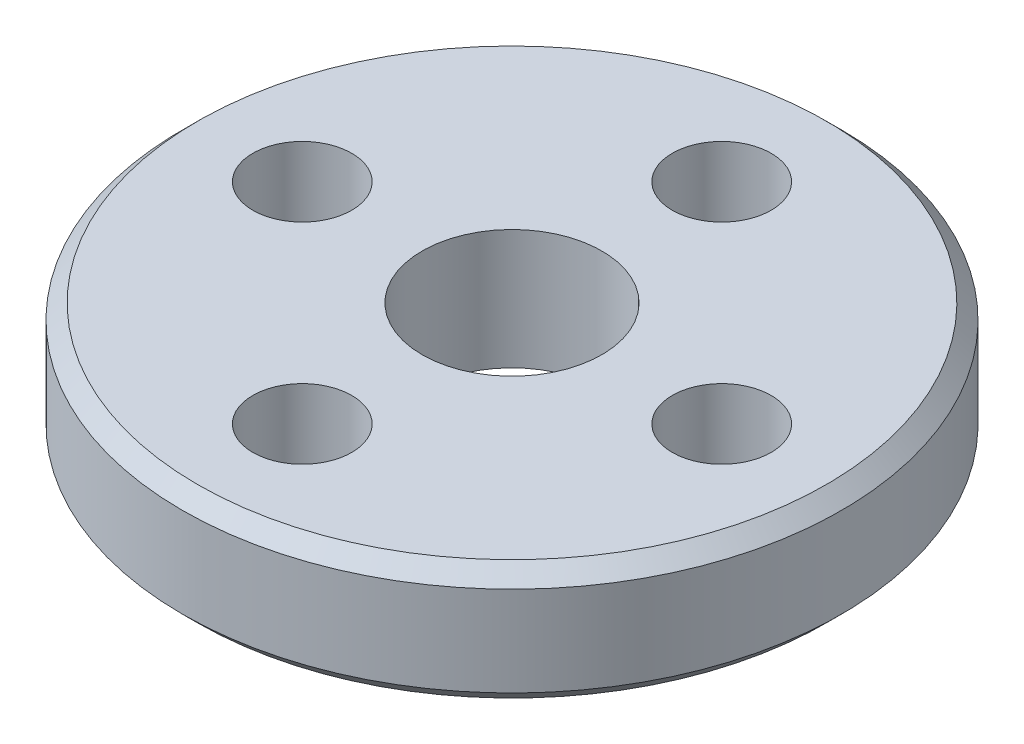
from build123d import *

# Parameters (mm, degrees)
ESQUISSE1_R        = 11
ESQUISSE1_R_2      = 1.65
ESQUISSE1_R_3      = 3
BOSS_EXTRU_1_DEPTH = 4
CHANFREIN1_SIZE    = 0.5


with BuildPart() as part:
    # Esquisse1 → Boss.-Extru.1 (new body)
    with BuildSketch(Plane(origin=(0, 0, 0), x_dir=(1, 0, 0), z_dir=(0, 1, 0))):
        with Locations(Location((0, 0, 0), (0, 0, 270))):
            Circle(ESQUISSE1_R)
        with Locations(Location((0, 7, 0), (0, 0, 270))):
            Circle(ESQUISSE1_R_2, mode=Mode.SUBTRACT)
        with Locations(Location((7, 0, 0), (0, 0, 270))):
            Circle(ESQUISSE1_R_2, mode=Mode.SUBTRACT)
        with Locations(Location((0, -7, 0), (0, 0, 270))):
            Circle(ESQUISSE1_R_2, mode=Mode.SUBTRACT)
        with Locations(Location((-7, 0, 0), (0, 0, 270))):
            Circle(ESQUISSE1_R_2, mode=Mode.SUBTRACT)
        with Locations(Location((0, 0, 0), (0, 0, 270))):
            Circle(ESQUISSE1_R_3, mode=Mode.SUBTRACT)
    extrude(amount=BOSS_EXTRU_1_DEPTH)

    # Chanfrein1
    chanfrein1_edges = [part.edges().sort_by_distance(p)[0] for p in [
        (0, 0, -11),
        (0, 4, -11),
    ]]
    chamfer(chanfrein1_edges, length=CHANFREIN1_SIZE)


solid = part.part
